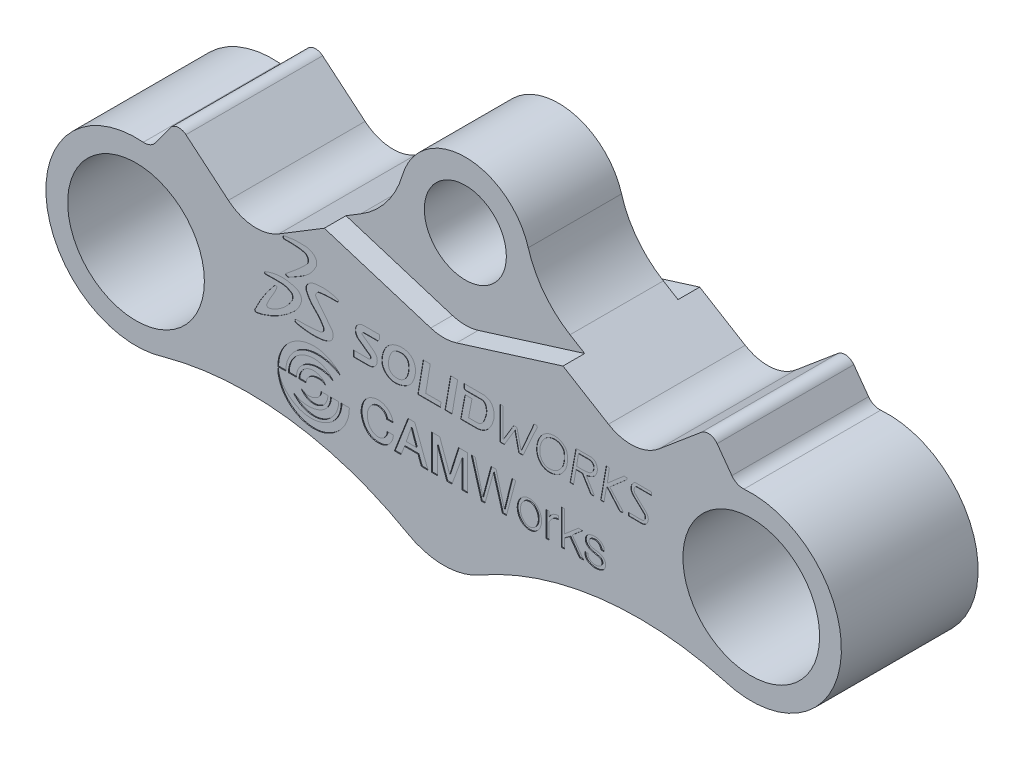
from build123d import *

# Parameters (mm, degrees)
BOSS_EXTRUDE1_DEPTH    = 10
FILLET19_R             = 6.35
FILLET20_R             = 1.5875
CUT_EXTRUDE2_DEPTH     = 3.175
FILLET9_R              = 6.35
FILLET14_R             = 6.35
F_12_0MM_DOWEL_HOLE1_D = 12
F_20_0MM_DOWEL_HOLE1_D = 20
CUT_EXTRUDE7_DEPTH     = 0.127
CUT_EXTRUDE9_DEPTH     = 0.0508


with BuildPart() as part:
    # Sketch1 → Boss-Extrude1 (new, symmetric)
    with BuildSketch(Plane.XY):
        with BuildLine():
            Line((42.159498417, 21.898846716), (39.006735293, 26.250767119))
            Line((39.006735293, 26.250767119), (28.002928508, 17.017476905))
            Line((28.002928508, 17.017476905), (15.313876057, 24.731519793))
            ThreePointArc((15.313876057, 24.731519793), (11.512733532, 28.141157169), (9.201143877, 32.694273113))
            ThreePointArc((9.201143877, 32.694273113), (0, 39.5875), (-9.201143877, 32.694273113))
            ThreePointArc((-9.201143877, 32.694273113), (-11.512733532, 28.141157169), (-15.313876057, 24.731519793))
            Line((-15.313876057, 24.731519793), (-28.002928508, 17.017476905))
            Line((-28.002928508, 17.017476905), (-39.006735293, 26.250767119))
            Line((-39.006735293, 26.250767119), (-42.159498417, 21.898846716))
            ThreePointArc((-42.159498417, 21.898846716), (-42.942336954, 21.255677054), (-43.939920777, 21.078674492))
            ThreePointArc((-43.939920777, 21.078674492), (-58.102214743, 6.444938733), (-41.016088524, -4.635723858))
            ThreePointArc((-41.016088524, -4.635723858), (-22.679836681, -3.323960892), (-5.247551006, -9.159564536))
            ThreePointArc((-5.247551006, -9.159564536), (0, -10.55625), (5.247551006, -9.159564536))
            ThreePointArc((5.247551006, -9.159564536), (22.679836681, -3.323960892), (41.016088524, -4.635723858))
            ThreePointArc((41.016088524, -4.635723858), (58.102214743, 6.444938733), (43.939920777, 21.078674492))
            ThreePointArc((43.939920777, 21.078674492), (42.942336954, 21.255677054), (42.159498417, 21.898846716))
        make_face()
    extrude(amount=BOSS_EXTRUDE1_DEPTH, both=True)

    # Fillet19
    fillet19_edges = [part.edges().sort_by_distance(p)[0] for p in [
        (28.002928508, 17.017476905, 0),
        (-28.002928508, 17.017476905, 0),
    ]]
    fillet(fillet19_edges, radius=FILLET19_R)

    # Fillet20
    fillet20_edges = [part.edges().sort_by_distance(p)[0] for p in [
        (39.006735293, 26.250767119, 0),
        (-39.006735293, 26.250767119, 0),
    ]]
    fillet(fillet20_edges, radius=FILLET20_R)

    # Sketch3 → Cut-Extrude2 (cut)
    with BuildSketch(Plane.XY.offset(10)):
        Polygon((-13.038987616, 44.246461893), (13.038987616, 44.246461893), (19.347324486, 24.017827298), (0, 17.984328605), (-19.347324486, 24.017827298), align=None)
    cut_extrude2 = extrude(amount=-CUT_EXTRUDE2_DEPTH, mode=Mode.SUBTRACT)

    # Fillet9
    fillet9_edges = [part.edges().sort_by_distance(p)[0] for p in [
        (0, 17.984328605, 8.4125),
    ]]
    fillet(fillet9_edges, radius=FILLET9_R)

    # Mirror13: Cut-Extrude2 across plane
    add(cut_extrude2.mirror(Plane.XY), mode=Mode.SUBTRACT)

    # Fillet14
    fillet14_edges = [part.edges().sort_by_distance(p)[0] for p in [
        (0, 17.984328605, -8.4125),
    ]]
    fillet(fillet14_edges, radius=FILLET14_R)

    # Ø12.0mm Dowel Hole1 (through all)
    with Locations(Plane.XY.offset(6.825)):
        with Locations((0, 30)):
            Hole(F_12_0MM_DOWEL_HOLE1_D / 2)

    # Ø20.0mm Dowel Hole1 (through all)
    with Locations(Plane.XY.offset(10)):
        with Locations((-45, 7.934714132), (45, 7.934714132)):
            Hole(F_20_0MM_DOWEL_HOLE1_D / 2)

    # Sketch20 → Cut-Extrude7 (cut)
    # profile 1 of 14: a face of its own
    with BuildSketch(Plane.XY.offset(10)):
        with BuildLine():
            add(Edge.make_bspline(
                [(-15.154845135, 5.962788169), (-15.578325694, 6.549836748), (-16.837528358, 7.448350373), (-18.961648523, 7.893001053), (-21.069184277, 7.44815324), (-23.412076262, 5.965768414), (-24.265528194, 3.858612653), (-24.26129315, 2.50635141)],
                knots=[0, 0, 0, 0, 0.17213689, 0.357725167, 0.501202943, 0.677745934, 1, 1, 1, 1], degree=3))
            Line((-24.26129315, 2.50635141), (-23.102441304, 2.50635141))
            add(Edge.make_bspline(
                [(-23.102441304, 2.50635141), (-23.097069308, 3.585922671), (-22.465123157, 5.225124628), (-20.549082761, 6.630138944), (-18.078018823, 7.11116476), (-16.196628222, 6.603943369), (-15.154845135, 5.962788169)],
                knots=[0, 0, 0, 0, 0.304366873, 0.466255188, 0.655370709, 1, 1, 1, 1], degree=3))
        make_face()
    # profile 2 of 14: a face of its own
    with BuildSketch(Plane.XY.offset(10)):
        with BuildLine():
            add(Edge.make_bspline(
                [(-17.245831982, 3.573554363), (-17.405493774, 3.905784033), (-17.976863302, 4.443993085), (-19.102146716, 4.703055663), (-20.533477397, 4.26164477), (-21.166460236, 3.22922874), (-21.137142585, 2.50635141)],
                knots=[0, 0, 0, 0, 0.202686739, 0.415279372, 0.607942049, 1, 1, 1, 1], degree=3))
            Line((-21.137142585, 2.50635141), (-20.130284256, 2.50635141))
            add(Edge.make_bspline(
                [(-20.130284256, 2.50635141), (-20.132402551, 2.959336263), (-19.632556635, 3.697544249), (-18.387076421, 4.036630122), (-17.576838627, 3.870423003), (-17.245831982, 3.573554363)],
                knots=[0, 0, 0, 0, 0.355167201, 0.653312356, 1, 1, 1, 1], degree=3))
        make_face()
    # profile 3 of 14: a face of its own
    with BuildSketch(Plane.XY.offset(10)):
        with BuildLine():
            add(Edge.make_bspline(
                [(-16.102800636, 4.673722033), (-16.659437016, 5.444632506), (-18.079126836, 6.325446328), (-20.165970666, 6.088538818), (-22.036821611, 5.05274492), (-22.715448931, 3.5248993), (-22.698757178, 2.50635141)],
                knots=[0, 0, 0, 0, 0.31313644, 0.50236644, 0.666443794, 1, 1, 1, 1], degree=3))
            Line((-22.698757178, 2.50635141), (-21.501624941, 2.50635141))
            add(Edge.make_bspline(
                [(-21.501624941, 2.50635141), (-21.58787462, 3.339798662), (-20.852406345, 4.588240409), (-19.121551814, 5.300006211), (-17.541941229, 5.311625203), (-16.553941295, 4.965750914), (-16.102800636, 4.673722033)],
                knots=[0, 0, 0, 0, 0.336821708, 0.56234389, 0.77094482, 1, 1, 1, 1], degree=3))
        make_face()
    # profile 4 of 14: a face of its own
    with BuildSketch(Plane.XY.offset(10)):
        with BuildLine():
            add(Edge.make_bspline(
                [(-20.829642183, 1.435482139), (-20.572440719, 0.981143184), (-19.817018621, 0.39467993), (-18.506105431, 0.377938727), (-17.301557854, 1.001109629), (-16.936098719, 1.96152892), (-16.928176734, 2.50635141)],
                knots=[0, 0, 0, 0, 0.28773554, 0.487574045, 0.695315024, 1, 1, 1, 1], degree=3))
            Line((-16.928176734, 2.50635141), (-17.959997916, 2.50635141))
            add(Edge.make_bspline(
                [(-17.959997916, 2.50635141), (-17.932048156, 1.82229001), (-19.008250224, 0.918546675), (-20.325645903, 1.043272546), (-20.829642183, 1.435482139)],
                knots=[0, 0, 0, 0, 0.49957784, 1, 1, 1, 1], degree=3))
        make_face()
    # profile 5 of 14: a face of its own
    with BuildSketch(Plane.XY.offset(10)):
        with BuildLine():
            add(Edge.make_bspline(
                [(-21.960424075, 0.342894049), (-21.534887241, -0.33617705), (-20.396288729, -1.012603155), (-18.535853049, -1.270982252), (-16.953146819, -0.656844224), (-15.733028159, 0.67661153), (-15.315960834, 1.862935087), (-15.408189038, 2.50635141)],
                knots=[0, 0, 0, 0, 0.257454808, 0.416874859, 0.605260486, 0.789877863, 1, 1, 1, 1], degree=3))
            Line((-15.408189038, 2.50635141), (-16.561806986, 2.50635141))
            add(Edge.make_bspline(
                [(-16.561806986, 2.50635141), (-16.511471384, 1.837059498), (-16.970201644, 0.679921892), (-18.401425093, -0.117874782), (-20.081264669, -0.401578151), (-21.309848105, -0.079997861), (-21.960424075, 0.342894049)],
                knots=[0, 0, 0, 0, 0.283056269, 0.482539175, 0.671247526, 1, 1, 1, 1], degree=3))
        make_face()
    # profile 6 of 14: a face of its own
    with BuildSketch(Plane.XY.offset(10)):
        with BuildLine():
            add(Edge.make_bspline(
                [(15.441899323, 2.693396798), (15.602035462, 2.902756432), (15.892726972, 3.462988431), (16.505400437, 3.609425693), (16.816078844, 3.615328702)],
                knots=[0, 0, 0, 0, 0.469307206, 1, 1, 1, 1], degree=3))
            Line((16.816078844, 3.615328702), (16.816078844, 4.127474505))
            add(Edge.make_bspline(
                [(16.816078844, 4.127474505), (16.275543308, 4.160186671), (15.691235328, 3.837714188), (15.441899323, 3.313429427)],
                knots=[0, 0, 0, 0, 1, 1, 1, 1], degree=3))
            Line((15.441899323, 3.313429427), (15.441899323, 4.031351101))
            Line((15.441899323, 4.031351101), (14.97561702, 4.031351101))
            Line((14.97561702, 4.031351101), (14.97561702, 0.3485751))
            Line((14.97561702, 0.3485751), (15.441899323, 0.3485751))
            Line((15.441899323, 0.3485751), (15.441899323, 2.693396798))
        make_face()
    # profile 7 of 14: a face of its own
    with BuildSketch(Plane.XY.offset(10)):
        with BuildLine():
            add(Edge.make_bspline(
                [(20.67107786, 1.528216872), (20.613953375, 1.221655034), (20.797858839, 0.647667647), (21.670749301, 0.165116883), (22.628151326, 0.131819602), (23.655705249, 0.624849989), (23.804693391, 1.669908639), (23.003932649, 2.450890522), (22.141467227, 2.455105406), (21.281007437, 2.701487333), (21.206579975, 3.530333453), (21.845868185, 3.724427066), (22.610636197, 3.788981938), (23.027282351, 3.128969869), (23.036675624, 2.906141513)],
                knots=[0, 0, 0, 0, 0.091070615, 0.156874293, 0.280394799, 0.36488583, 0.466496103, 0.536468143, 0.665478679, 0.716572617, 0.778127638, 0.846119657, 0.890812251, 1, 1, 1, 1], degree=3))
            Line((23.036675624, 2.906141513), (23.49122029, 2.906141513))
            add(Edge.make_bspline(
                [(23.49122029, 2.906141513), (23.50687304, 3.302073861), (23.43770383, 3.574529519), (22.817415308, 4.130123172), (22.063336854, 4.200612601), (21.439105471, 4.112384908), (20.79617851, 3.6676207), (20.604844787, 2.868148864), (21.420153209, 2.029246431), (22.299125952, 2.019386461), (23.104530145, 1.719891976), (23.279304278, 1.022216597), (22.557776527, 0.550353966), (21.619512601, 0.581079625), (21.000875285, 1.120489437), (21.119649084, 1.528216872)],
                knots=[0, 0, 0, 0, 0.067061893, 0.148974799, 0.203040078, 0.28681956, 0.328691497, 0.425200419, 0.488568397, 0.640215096, 0.674333456, 0.728187294, 0.813903484, 0.886702844, 1, 1, 1, 1], degree=3))
            Line((21.119649084, 1.528216872), (20.67107786, 1.528216872))
        make_face()
    # profile 8 of 14: a face of its own
    with BuildSketch(Plane.XY.offset(10)):
        with BuildLine():
            add(Edge.make_bspline(
                [(-8.253737619, 2.278747085), (-8.261737772, 1.726367618), (-8.894810308, 0.803328862), (-10.146225272, 0.954264904), (-10.822225065, 1.514190474), (-11.231846307, 2.528922229), (-11.160611268, 3.826486548), (-10.127154363, 4.983623712), (-8.783774058, 4.762476757), (-8.363145772, 4.08237895), (-8.346465372, 3.792109582)],
                knots=[0, 0, 0, 0, 0.179682053, 0.286072628, 0.363963482, 0.4521715, 0.627882231, 0.757862959, 0.910918307, 1, 1, 1, 1], degree=3))
            Line((-8.346465372, 3.792109582), (-7.409708046, 3.792109582))
            add(Edge.make_bspline(
                [(-7.409708046, 3.792109582), (-7.461206133, 4.665433762), (-8.60299766, 5.763666694), (-10.334564404, 5.595248979), (-11.617114969, 4.812707555), (-12.19649888, 3.344718515), (-11.934060251, 1.63556273), (-11.070868107, 0.46369399), (-9.677060812, 0.085191867), (-8.29345954, 0.305226166), (-7.493922171, 1.389534833), (-7.351601244, 2.056390727), (-7.374414812, 2.278747085)],
                knots=[0, 0, 0, 0, 0.175330696, 0.271236919, 0.338579899, 0.473109905, 0.57073625, 0.688740776, 0.747216662, 0.858562083, 0.957456763, 1, 1, 1, 1], degree=3))
            Line((-7.374414812, 2.278747085), (-8.253737619, 2.278747085))
        make_face()
    # profile 9 of 14: a face of its own
    with BuildSketch(Plane.XY.offset(10)):
        Polygon((1.210832331, 0.3485751), (2.681056399, 4.343364089), (2.681056399, 0.3485751), (3.493396608, 0.3485751), (3.493396608, 5.457765475), (2.178928778, 5.457765475), (0.889354837, 1.40777763), (-0.57144251, 5.461001415), (-1.763817842, 5.461001415), (-1.763817842, 0.3485751), (-0.919861843, 0.3485751), (-0.919861843, 4.212080427), (0.472560247, 0.3485751), align=None)
    # profile 10 of 14: a face of its own
    with BuildSketch(Plane.XY.offset(10)):
        with BuildLine():
            add(Edge.make_bspline(
                [(-14.997707795, 2.50635141), (-14.98648072, 1.545350159), (-15.729691015, -0.601005149), (-18.510422409, -1.76504958), (-21.465048224, -1.422639309), (-23.60016443, 0.183714613), (-24.167802042, 1.926466653), (-24.206631157, 2.489048279)],
                knots=[0.001261012, 0.001261012, 0.001261012, 0.001261012, 0.216474276, 0.470315596, 0.597834181, 0.876935572, 1, 1, 1, 1], degree=3))
            Line((-24.206631157, 2.489048279), (-24.261798656, 2.489048279))
            add(Edge.make_bspline(
                [(-24.261798656, 2.489048279), (-24.269621802, 2.203115398), (-24.21864849, 1.407758141), (-23.839857018, 0.20666636), (-22.824455842, -1.274247865), (-20.904580847, -2.645070192), (-18.171617334, -2.928579089), (-16.051476509, -1.889375611), (-14.327745425, -0.224233421), (-13.777862041, 1.416031905), (-13.802751288, 2.50635141)],
                knots=[0, 0, 0, 0, 0.05256655, 0.14551147, 0.227178518, 0.378977625, 0.564372139, 0.699237559, 0.80001659, 0.998939544, 0.998939544, 0.998939544, 0.998939544], degree=3))
            Line((-13.802751288, 2.50635141), (-14.997707795, 2.50635141))
        make_face()
    # profile 11 of 14: a face of its own
    with BuildSketch(Plane.XY.offset(10)):
        Polygon((-6.239149138, 0.3485751), (-5.728469786, 1.660665445), (-3.755280049, 1.660665445), (-3.260193959, 0.3485751), (-2.295667713, 0.3485751), (-4.224720206, 5.461001415), (-5.212030536, 5.461001415), (-7.201840588, 0.3485751), align=None)
        Polygon((-5.468142485, 2.391298414), (-4.741874917, 4.510218278), (-3.988781582, 2.391298414), align=None, mode=Mode.SUBTRACT)
    # profile 12 of 14: a face of its own
    with BuildSketch(Plane.XY.offset(10)):
        Polygon((17.215169145, 5.461001415), (17.215169145, 0.3485751), (17.691619779, 0.3485751), (17.691619779, 1.761807623), (18.469498994, 2.316524438), (19.872871869, 0.3485751), (20.48534593, 0.3485751), (18.813219975, 2.693396798), (20.335561706, 4.007401655), (19.70180655, 4.007401655), (17.691619779, 2.272314765), (17.691619779, 5.461001415), align=None)
    # profile 13 of 14: a face of its own
    with BuildSketch(Plane.XY.offset(10)):
        Polygon((4.613634742, 5.457765475), (4.032825664, 5.457765475), (5.522013992, 0.3485751), (6.050635431, 0.3485751), (7.288694063, 4.831779715), (8.595424777, 0.3485751), (9.181625449, 0.3485751), (10.546284711, 5.461001415), (10.000749439, 5.461001415), (8.888525113, 0.9777968), (7.667385634, 5.461001415), (6.9340126, 5.461001415), (5.737311401, 0.9777968), align=None)
    # profile 14 of 14: a face of its own
    with BuildSketch(Plane.XY.offset(10)):
        with BuildLine():
            add(Edge.make_bspline(
                [(12.459760097, 0.197683891), (15.538295891, 0.068210118), (14.125596955, 3.142414219), (12.712898018, 6.216618319), (11.047061161, 3.271887992), (9.381224303, 0.327157664), (12.459760097, 0.197683891)],
                knots=[0, 0, 0, 2.094395102, 2.094395102, 4.188790205, 4.188790205, 6.283185307, 6.283185307, 6.283185307], degree=2, weights=[1, 0.5, 1, 0.5, 1, 0.5, 1]))
        make_face()
        with BuildLine():
            add(Edge.make_bspline(
                [(12.544139404, 3.792109582), (10.270503805, 3.792109582), (11.407321604, 1.40993826), (12.544139404, -0.972233063), (13.680957204, 1.40993826), (14.817775004, 3.792109582), (12.544139404, 3.792109582)],
                knots=[0, 0, 0, 2.094395102, 2.094395102, 4.188790205, 4.188790205, 6.283185307, 6.283185307, 6.283185307], degree=2, weights=[1, 0.5, 1, 0.5, 1, 0.5, 1]))
        make_face(mode=Mode.SUBTRACT)
    extrude(amount=-CUT_EXTRUDE7_DEPTH, mode=Mode.SUBTRACT)

    # Sketch22 → Cut-Extrude9 (cut)
    # profile 1 of 13: a face of its own
    with BuildSketch(Plane.XY.offset(10)):
        with BuildLine():
            add(Edge.make_bspline(
                [(-6.327227707, 13.98099488), (-6.892418819, 13.941336041), (-7.837941125, 13.606200654), (-8.656637104, 12.599626065), (-9.023613545, 11.512977465), (-9.13228307, 10.188477062), (-8.31716132, 9.312819274), (-7.261084599, 8.928536198), (-6.153509311, 9.073071649), (-4.844950051, 9.760553078), (-4.156198652, 11.105425367), (-4.023008951, 12.544566088), (-4.628729918, 13.560320366), (-5.454753741, 13.952698573), (-5.995744906, 14.004254664), (-6.327227707, 13.98099488)],
                knots=[0, 0, 0, 0, 0.108437372, 0.182277357, 0.243087303, 0.330527441, 0.425194381, 0.446032953, 0.5477977, 0.628437139, 0.724076823, 0.826878908, 0.896495288, 0.936401824, 1, 1, 1, 1], degree=3))
        make_face()
        with BuildLine():
            add(Edge.make_bspline(
                [(-6.342709592, 13.224241614), (-6.684772844, 13.203135765), (-7.227033881, 13.085742272), (-7.687908942, 12.507893936), (-7.899013457, 12.003011627), (-8.041528632, 11.499426015), (-8.05154879, 11.144407037), (-8.050373721, 10.814760413), (-8.035907066, 10.402222327), (-7.72110397, 9.968019534), (-7.099668959, 9.729441371), (-6.370538156, 9.698770427), (-5.564583762, 10.223549685), (-5.119834696, 11.178636366), (-5.043606515, 12.123450414), (-5.268843296, 12.844363123), (-5.617918173, 13.079786873), (-5.953567066, 13.232189936), (-6.210485367, 13.23240006), (-6.342709592, 13.224241614)],
                knots=[0, 0, 0, 0, 0.097807515, 0.150245541, 0.208881987, 0.257422323, 0.302121709, 0.311658493, 0.352790166, 0.422067893, 0.450224506, 0.546400305, 0.621191585, 0.717547723, 0.842550186, 0.893983943, 0.925618741, 0.962192598, 1, 1, 1, 1], degree=3))
        make_face(mode=Mode.SUBTRACT)
    # profile 2 of 13: a face of its own
    with BuildSketch(Plane.XY.offset(10)):
        Polygon((-2.981655961, 13.98099488), (-3.771990861, 9.224872356), (-0.494452815, 9.224872356), (-0.37681203, 9.932817795), (-2.626660968, 9.932817795), (-1.953966853, 13.98099488), align=None)
    # profile 3 of 13: a face of its own
    with BuildSketch(Plane.XY.offset(10)):
        Polygon((1.021138835, 13.98099488), (2.049933801, 13.98099488), (1.230502596, 9.224872356), (0.20170763, 9.224872356), align=None)
    # profile 4 of 13: a face of its own
    with BuildSketch(Plane.XY.offset(10)):
        with BuildLine():
            Line((3.131437911, 12.63463459), (4.147591219, 12.63463459))
            Line((4.147591219, 12.63463459), (3.647489464, 9.968672777))
            Line((3.647489464, 9.968672777), (4.830989687, 9.968672777))
            ThreePointArc((4.830989687, 9.968672777), (5.464663164, 10.16714974), (5.871887341, 10.691652981))
            ThreePointArc((5.871887341, 10.691652981), (6.061920315, 11.139553428), (6.204732421, 11.604668515))
            ThreePointArc((6.204732421, 11.604668515), (6.259642102, 12.199280867), (6.131532553, 12.782519124))
            ThreePointArc((6.131532553, 12.782519124), (5.888495119, 13.088986008), (5.514838785, 13.204615109))
            Line((5.514838785, 13.204615109), (3.261432825, 13.204615109))
            ThreePointArc((3.261432825, 13.204615109), (3.091153867, 13.256353096), (2.978441175, 13.394075978))
            Line((2.978441175, 13.394075978), (2.978441175, 13.98099488))
            Line((2.978441175, 13.98099488), (5.702943969, 13.98099488))
            ThreePointArc((5.702943969, 13.98099488), (6.049298011, 13.951824465), (6.385894177, 13.865135041))
            ThreePointArc((6.385894177, 13.865135041), (6.865766966, 13.576285808), (7.190050987, 13.119611256))
            ThreePointArc((7.190050987, 13.119611256), (7.385003109, 12.354486571), (7.325850808, 11.567134604))
            ThreePointArc((7.325850808, 11.567134604), (7.082922578, 10.86230367), (6.711658758, 10.215802358))
            ThreePointArc((6.711658758, 10.215802358), (5.868865814, 9.482380116), (4.783313131, 9.218214441))
            Line((4.783313131, 9.218214441), (2.490559371, 9.218214441))
            Line((2.490559371, 9.218214441), (3.131437911, 12.63463459))
        make_face()
    # profile 5 of 13: a face of its own
    with BuildSketch(Plane.XY.offset(10)):
        with BuildLine():
            Line((-9.411192675, 13.98099488), (-11.733865385, 13.98099488))
            ThreePointArc((-11.733865385, 13.98099488), (-12.865007326, 13.159490251), (-12.433741638, 11.829692578))
            Line((-12.433741638, 11.829692578), (-10.788049407, 10.632174754))
            ThreePointArc((-10.788049407, 10.632174754), (-10.68072848, 10.340737613), (-10.908850447, 10.129991898))
            Line((-10.908850447, 10.129991898), (-13.193321861, 10.129991898))
            Line((-13.193321861, 10.129991898), (-13.193321861, 9.259913225))
            Line((-13.193321861, 9.259913225), (-10.952540436, 9.259913225))
            ThreePointArc((-10.952540436, 9.259913225), (-9.765906277, 10.130970661), (-10.241318887, 11.524105447))
            Line((-10.241318887, 11.524105447), (-11.839274936, 12.686887171))
            ThreePointArc((-11.839274936, 12.686887171), (-11.920188148, 12.881912991), (-11.783573702, 13.042905262))
            Line((-11.783573702, 13.042905262), (-9.651966546, 13.042905262))
            Line((-9.651966546, 13.042905262), (-9.411192675, 13.355652447))
            Line((-9.411192675, 13.355652447), (-9.411192675, 13.98099488))
        make_face()
    # profile 6 of 13: a face of its own
    with BuildSketch(Plane.XY.offset(10)):
        Polygon((8.245611292, 13.98099488), (8.245611292, 9.188099975), (8.875278067, 9.188099975), (10.422237182, 11.76882994), (10.99748831, 9.188099975), (11.603834093, 9.188099975), (13.701312884, 13.793521065), (13.659524505, 13.98099488), (13.232786978, 13.98099488), (11.389406362, 9.722722206), (11.300661201, 9.722722206), (10.730465896, 12.280770402), (10.24497423, 12.280770402), (8.763938904, 9.810018454), (8.670419954, 9.810018454), (8.717179429, 13.98099488), align=None)
    # profile 7 of 13: a face of its own
    with BuildSketch(Plane.XY.offset(10)):
        with BuildLine():
            Line((19.355876074, 13.949663892), (18.497893152, 9.188099975))
            Line((18.497893152, 9.188099975), (19.000885535, 9.188099975))
            Line((19.000885535, 9.188099975), (19.37106672, 11.242501445))
            Line((19.37106672, 11.242501445), (20.287651007, 11.242501445))
            Line((20.287651007, 11.242501445), (21.544318716, 9.188099975))
            Line((21.544318716, 9.188099975), (21.876483498, 9.188099975))
            Line((21.876483498, 9.188099975), (21.971387721, 9.259913225))
            Line((21.971387721, 9.259913225), (21.971387721, 9.44553875))
            Line((21.971387721, 9.44553875), (20.932186477, 11.144425852))
            Line((20.932186477, 11.144425852), (20.932186477, 11.281573036))
            ThreePointArc((20.932186477, 11.281573036), (21.253148974, 11.353342841), (21.562538149, 11.464905238))
            ThreePointArc((21.562538149, 11.464905238), (21.668794477, 11.515196372), (21.771509581, 11.572373402))
            ThreePointArc((21.771509581, 11.572373402), (22.389268387, 12.3132356), (22.413644351, 13.277553262))
            ThreePointArc((22.413644351, 13.277553262), (22.062923722, 13.763759443), (21.492975527, 13.949663892))
            Line((21.492975527, 13.949663892), (19.355876074, 13.949663892))
        make_face()
        with BuildLine():
            Line((19.719305172, 13.46932146), (19.454981613, 11.722523223))
            Line((19.454981613, 11.722523223), (20.327389526, 11.722523223))
            ThreePointArc((20.327389526, 11.722523223), (20.727197513, 11.739009364), (21.124290882, 11.78835585))
            ThreePointArc((21.124290882, 11.78835585), (21.736507758, 12.138822579), (21.972247258, 12.803701003))
            ThreePointArc((21.972247258, 12.803701003), (21.971818688, 12.820523832), (21.971015805, 12.837332956))
            ThreePointArc((21.971015805, 12.837332956), (21.761327536, 13.286412808), (21.300690684, 13.46932146))
            Line((21.300690684, 13.46932146), (19.719305172, 13.46932146))
        make_face(mode=Mode.SUBTRACT)
    # profile 8 of 13: a face of its own
    with BuildSketch(Plane.XY.offset(10)):
        Polygon((23.789909669, 13.949658937), (22.967837997, 9.188099975), (23.456919121, 9.188099975), (23.818352196, 11.281573036), (23.946000245, 11.281573036), (25.767046983, 9.188099975), (26.162474275, 9.188099975), (26.26049425, 9.381261212), (24.297369568, 11.526649411), (26.803091454, 13.700890557), (26.803091454, 13.949663892), (26.386543327, 13.949663892), (23.946000245, 11.831979076), (24.234378003, 13.825277225), (24.126450687, 13.949658937), align=None)
    # profile 9 of 13: a face of its own
    with BuildSketch(Plane.XY.offset(10)):
        with BuildLine():
            Line((30.431527076, 13.949663892), (28.177082316, 13.949663892))
            ThreePointArc((28.177082316, 13.949663892), (27.989899949, 13.917881368), (27.823698677, 13.826096269))
            ThreePointArc((27.823698677, 13.826096269), (27.405294954, 13.004083441), (27.750508491, 12.148750536))
            Line((27.750508491, 12.148750536), (29.293818169, 10.681982558))
            ThreePointArc((29.293818169, 10.681982558), (29.47973215, 10.263740712), (29.315587895, 9.836485619))
            ThreePointArc((29.315587895, 9.836485619), (29.145805436, 9.718769046), (28.943153867, 9.678574311))
            Line((28.943153867, 9.678574311), (27.04827258, 9.696417213))
            Line((27.04827258, 9.696417213), (27.043967607, 9.239237481))
            Line((27.043967607, 9.239237481), (28.938848894, 9.221394579))
            ThreePointArc((28.938848894, 9.221394579), (29.324277655, 9.297842084), (29.647191724, 9.52173057))
            ThreePointArc((29.647191724, 9.52173057), (29.936780675, 10.275508728), (29.608784822, 11.013385406))
            Line((29.608784822, 11.013385406), (28.065475145, 12.480153383))
            ThreePointArc((28.065475145, 12.480153383), (27.862060327, 12.984152701), (28.108601983, 13.468518381))
            ThreePointArc((28.108601983, 13.468518381), (28.140809242, 13.486304926), (28.177082316, 13.492463892))
            Line((28.177082316, 13.492463892), (30.431527076, 13.492463892))
            Line((30.431527076, 13.492463892), (30.431527076, 13.949663892))
        make_face()
    # profile 10 of 13: a face of its own
    with BuildSketch(Plane.XY.offset(10)):
        with BuildLine():
            Line((-23.038987465, 14.907775389), (-21.862660542, 15.87328674))
            ThreePointArc((-21.862660542, 15.87328674), (-20.935890521, 16.678624248), (-20.055852546, 17.534780972))
            ThreePointArc((-20.055852546, 17.534780972), (-19.823878757, 18.172011085), (-20.145836732, 18.768850358))
            ThreePointArc((-20.145836732, 18.768850358), (-20.225373428, 18.819300991), (-20.312580885, 18.85488486))
            ThreePointArc((-20.312580885, 18.85488486), (-20.901205042, 18.997297529), (-21.502800906, 19.066883337))
            ThreePointArc((-21.502800906, 19.066883337), (-22.395710721, 19.101036892), (-23.289254004, 19.106936562))
            ThreePointArc((-23.289254004, 19.106936562), (-23.307872831, 19.107430502), (-23.326408856, 19.109252726))
            ThreePointArc((-23.326408856, 19.109252726), (-23.513236325, 19.318627486), (-23.334945161, 19.535317482))
            ThreePointArc((-23.334945161, 19.535317482), (-22.722704062, 19.635411541), (-22.108282109, 19.721106625))
            ThreePointArc((-22.108282109, 19.721106625), (-21.790311413, 19.753599595), (-21.47111393, 19.7701563))
            ThreePointArc((-21.47111393, 19.7701563), (-20.845576707, 19.775462664), (-20.220265465, 19.757832413))
            ThreePointArc((-20.220265465, 19.757832413), (-19.672244053, 19.664325474), (-19.169917273, 19.426126354))
            ThreePointArc((-19.169917273, 19.426126354), (-18.991119477, 19.290450077), (-18.832826067, 19.131327796))
            ThreePointArc((-18.832826067, 19.131327796), (-18.570729767, 18.541318199), (-18.681589299, 17.905302508))
            ThreePointArc((-18.681589299, 17.905302508), (-19.52964736, 16.684475271), (-20.680665881, 15.743848895))
            ThreePointArc((-20.680665881, 15.743848895), (-21.652800458, 15.170723761), (-22.639711715, 14.623435696))
            ThreePointArc((-22.639711715, 14.623435696), (-22.825505108, 14.576673165), (-23.011298501, 14.623435696))
            ThreePointArc((-23.011298501, 14.623435696), (-23.101027967, 14.758215872), (-23.038987465, 14.907775389))
        make_face()
    # profile 11 of 13: a face of its own
    with BuildSketch(Plane.XY.offset(10)):
        with BuildLine():
            ThreePointArc((-24.754196419, 12.515219448), (-26.345986559, 10.402884871), (-27.614892709, 8.082188769))
            ThreePointArc((-27.614892709, 8.082188769), (-27.591500113, 7.866403812), (-27.390875233, 7.783578583))
            ThreePointArc((-27.390875233, 7.783578583), (-26.915201874, 7.871007001), (-26.447453423, 7.993971465))
            ThreePointArc((-26.447453423, 7.993971465), (-23.96037017, 9.090568364), (-21.807079106, 10.749316523))
            ThreePointArc((-21.807079106, 10.749316523), (-21.213530042, 11.501744377), (-20.82625379, 12.378365886))
            ThreePointArc((-20.82625379, 12.378365886), (-20.784552036, 12.753612089), (-20.877252409, 13.119611255))
            ThreePointArc((-20.877252409, 13.119611255), (-21.184320371, 13.532936802), (-21.634003399, 13.783763267))
            ThreePointArc((-21.634003399, 13.783763267), (-21.944338553, 13.873746001), (-22.257243716, 13.954338545))
            ThreePointArc((-22.257243716, 13.954338545), (-23.970991033, 14.112319731), (-25.658291059, 13.77334105))
            ThreePointArc((-25.658291059, 13.77334105), (-25.903418429, 13.68458418), (-26.147819531, 13.593846585))
            ThreePointArc((-26.147819531, 13.593846585), (-26.231200139, 13.47704397), (-26.154651794, 13.355653988))
            ThreePointArc((-26.154651794, 13.355653988), (-25.987209135, 13.303985588), (-25.812336183, 13.292755367))
            ThreePointArc((-25.812336183, 13.292755367), (-24.736485865, 13.321510815), (-23.660636213, 13.292730471))
            ThreePointArc((-23.660636213, 13.292730471), (-23.165872501, 13.216197868), (-22.696172551, 13.042905262))
            ThreePointArc((-22.696172551, 13.042905262), (-22.507435595, 12.948621228), (-22.320592327, 12.850638012))
            ThreePointArc((-22.320592327, 12.850638012), (-22.20524134, 12.75565181), (-22.134939692, 12.62379618))
            ThreePointArc((-22.134939692, 12.62379618), (-22.099705903, 12.216566021), (-22.231640586, 11.829692578))
            ThreePointArc((-22.231640586, 11.829692578), (-23.485283445, 10.353345634), (-25.155319014, 9.37242672))
            ThreePointArc((-25.155319014, 9.37242672), (-25.397923934, 9.298789817), (-25.648314716, 9.258990368))
            ThreePointArc((-25.648314716, 9.258990368), (-25.838834912, 9.343364335), (-25.868300821, 9.549637628))
            ThreePointArc((-25.868300821, 9.549637628), (-25.505293738, 10.345610535), (-25.067323755, 11.102927712))
            ThreePointArc((-25.067323755, 11.102927712), (-24.694474063, 11.758976414), (-24.396928027, 12.452433803))
            ThreePointArc((-24.396928027, 12.452433803), (-24.404704589, 12.549297627), (-24.48314991, 12.60665098))
            ThreePointArc((-24.48314991, 12.60665098), (-24.631005199, 12.597493225), (-24.754196419, 12.515219448))
        make_face()
    # profile 12 of 13: a face of its own
    with BuildSketch(Plane.XY.offset(10)):
        with BuildLine():
            ThreePointArc((18.011848044, 11.046635095), (18.117741528, 11.826584404), (18.073248047, 12.612430881))
            ThreePointArc((18.073248047, 12.612430881), (17.937143133, 13.032880864), (17.675148589, 13.388776346))
            ThreePointArc((17.675148589, 13.388776346), (17.385261782, 13.62871605), (17.059316238, 13.816771694))
            ThreePointArc((17.059316238, 13.816771694), (16.240188016, 13.963180535), (15.419561031, 13.825420081))
            ThreePointArc((15.419561031, 13.825420081), (14.681372726, 13.41598508), (14.120074591, 12.785506376))
            ThreePointArc((14.120074591, 12.785506376), (13.879689757, 12.327525884), (13.711005001, 11.838571437))
            ThreePointArc((13.711005001, 11.838571437), (13.614798535, 11.277289349), (13.617074795, 10.70782637))
            ThreePointArc((13.617074795, 10.70782637), (13.825315759, 9.980867067), (14.28608354, 9.381261212))
            ThreePointArc((14.28608354, 9.381261212), (14.665647295, 9.1295429), (15.100509483, 8.994170708))
            ThreePointArc((15.100509483, 8.994170708), (16.268773328, 9.091100889), (17.256898359, 9.721850282))
            ThreePointArc((17.256898359, 9.721850282), (17.479415212, 9.979233362), (17.676723179, 10.256414468))
            ThreePointArc((17.676723179, 10.256414468), (17.878031476, 10.637213489), (18.011848044, 11.046635095))
        make_face()
        with BuildLine():
            ThreePointArc((15.571133141, 13.394075978), (16.227337278, 13.506014423), (16.883541415, 13.394075978))
            ThreePointArc((16.883541415, 13.394075978), (17.132808069, 13.247359107), (17.355089138, 13.062289306))
            ThreePointArc((17.355089138, 13.062289306), (17.530312967, 12.824263856), (17.62134091, 12.543063893))
            ThreePointArc((17.62134091, 12.543063893), (17.660892638, 11.844498952), (17.566760415, 11.151176199))
            ThreePointArc((17.566760415, 11.151176199), (17.457118461, 10.815718596), (17.292177486, 10.50371277))
            ThreePointArc((17.292177486, 10.50371277), (17.119848424, 10.261622392), (16.925501884, 10.03682364))
            ThreePointArc((16.925501884, 10.03682364), (16.122588869, 9.524300547), (15.173301868, 9.44553875))
            ThreePointArc((15.173301868, 9.44553875), (14.861910597, 9.54247456), (14.590116811, 9.722722206))
            ThreePointArc((14.590116811, 9.722722206), (14.233540595, 10.186741601), (14.072388322, 10.749316523))
            ThreePointArc((14.072388322, 10.749316523), (14.070429196, 11.239440427), (14.153231925, 11.722523223))
            ThreePointArc((14.153231925, 11.722523223), (14.299401104, 12.146213377), (14.507700031, 12.543063893))
            ThreePointArc((14.507700031, 12.543063893), (14.967037661, 13.059015355), (15.571133141, 13.394075978))
        make_face(mode=Mode.SUBTRACT)
    # profile 13 of 13: a face of its own
    with BuildSketch(Plane.XY.offset(10)):
        with BuildLine():
            ThreePointArc((-15.662029124, 15.464576643), (-17.283013708, 15.776545661), (-18.930600121, 15.674689393))
            ThreePointArc((-18.930600121, 15.674689393), (-19.521744212, 15.438598074), (-19.981132909, 14.997970711))
            ThreePointArc((-19.981132909, 14.997970711), (-20.134388643, 14.598332156), (-20.079187703, 14.173889992))
            ThreePointArc((-20.079187703, 14.173889992), (-19.607828103, 13.281782408), (-18.954691922, 12.51272523))
            ThreePointArc((-18.954691922, 12.51272523), (-18.232035157, 11.727847093), (-17.62406908, 10.851123797))
            ThreePointArc((-17.62406908, 10.851123797), (-17.544837484, 10.563386484), (-17.62406908, 10.275649171))
            ThreePointArc((-17.62406908, 10.275649171), (-17.80623278, 10.086417847), (-18.053286176, 9.997217361))
            ThreePointArc((-18.053286176, 9.997217361), (-19.775110253, 9.851536366), (-21.502800906, 9.820133988))
            ThreePointArc((-21.502800906, 9.820133988), (-21.725515791, 9.698869145), (-21.736952245, 9.44553875))
            ThreePointArc((-21.736952245, 9.44553875), (-21.699367863, 9.39957688), (-21.645939189, 9.373683714))
            ThreePointArc((-21.645939189, 9.373683714), (-20.9703876, 9.230374337), (-20.288472328, 9.1212914))
            ThreePointArc((-20.288472328, 9.1212914), (-19.077004938, 9.040358249), (-17.865537549, 9.1212914))
            ThreePointArc((-17.865537549, 9.1212914), (-17.234621491, 9.272317692), (-16.64713163, 9.547489776))
            ThreePointArc((-16.64713163, 9.547489776), (-16.437260416, 9.719984941), (-16.287003917, 9.946311016))
            ThreePointArc((-16.287003917, 9.946311016), (-16.1781504, 10.638350196), (-16.455696238, 11.281573036))
            ThreePointArc((-16.455696238, 11.281573036), (-17.553997893, 12.647324882), (-18.619869072, 14.038534163))
            ThreePointArc((-18.619869072, 14.038534163), (-18.711365307, 14.263062998), (-18.68159143, 14.503683601))
            ThreePointArc((-18.68159143, 14.503683601), (-18.477330707, 14.776342945), (-18.163306208, 14.908457194))
            ThreePointArc((-18.163306208, 14.908457194), (-16.921897963, 15.021108939), (-15.675402282, 15.026884898))
            ThreePointArc((-15.675402282, 15.026884898), (-15.540150695, 15.046518778), (-15.420811501, 15.113126869))
            ThreePointArc((-15.420811501, 15.113126869), (-15.369432371, 15.222366701), (-15.420811501, 15.331606532))
            ThreePointArc((-15.420811501, 15.331606532), (-15.535161308, 15.409445884), (-15.662029124, 15.464576643))
        make_face()
    extrude(amount=-CUT_EXTRUDE9_DEPTH, mode=Mode.SUBTRACT)


solid = part.part
